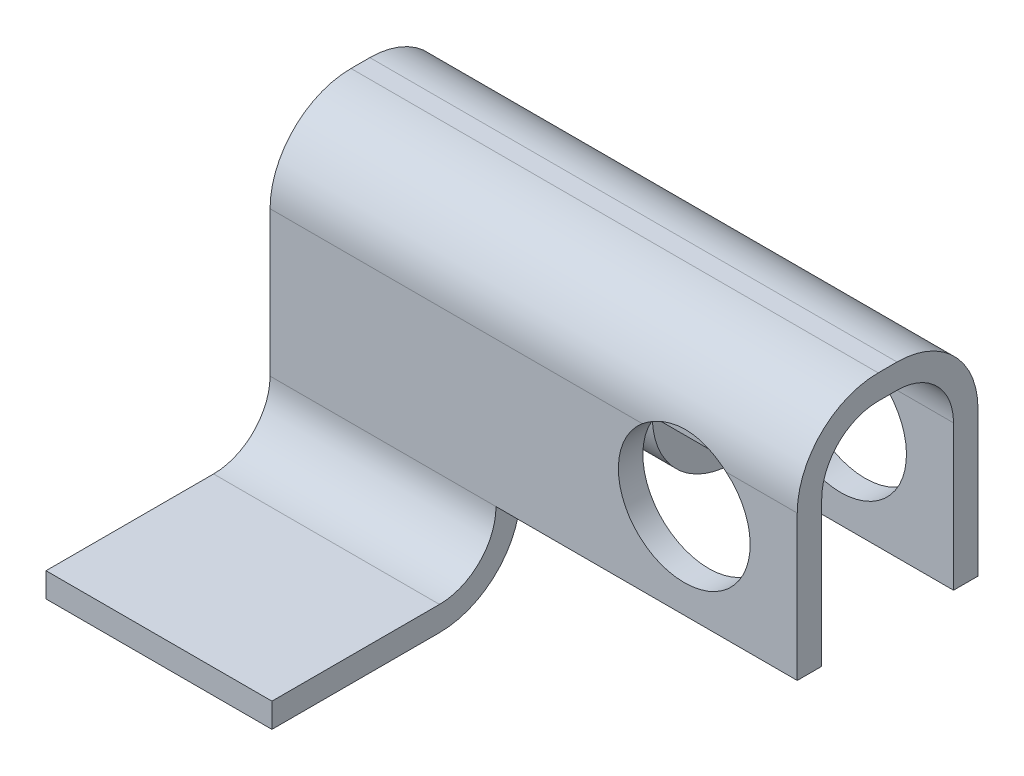
from build123d import *

# Parameters (mm, degrees)
EXTRUDE_1_DEPTH       = 14
CUT_EXTRUDE_START     = 3
SKETCH_3_W            = 16
SKETCH_3_H            = 33.4
CUT_EXTRUDE_1_DEPTH   = 30.455434224
HOLE_WIZARD_7_0_7_1_D = 7


with BuildPart() as part:
    # 草图1 → 拉伸-薄壁1 (new, symmetric)
    with BuildSketch(Plane(origin=(0, 0, 0), x_dir=(0, 0, -1), z_dir=(1, 0, 0))):
        with BuildLine():
            Line((-16.7, 0), (-7.8, 0))
            ThreePointArc((-7.8, 0), (-4.759440841, 1.259440841), (-3.5, 4.3))
            Line((-3.5, 4.3), (-3.5, 12))
            ThreePointArc((-3.5, 12), (-2.621320344, 14.121320344), (-0.5, 15))
            Line((-0.5, 15), (0.5, 15))
            ThreePointArc((0.5, 15), (2.621320344, 14.121320344), (3.5, 12))
            Line((3.5, 12), (3.5, 4.3))
            ThreePointArc((3.5, 4.3), (4.759440841, 1.259440841), (7.8, 0))
            Line((7.8, 0), (16.7, 0))
            Line((16.7, 0), (16.7, 1.3))
            Line((16.7, 1.3), (7.8, 1.3))
            ThreePointArc((7.8, 1.3), (5.678679656, 2.178679656), (4.8, 4.3))
            Line((4.8, 4.3), (4.8, 12))
            ThreePointArc((4.8, 12), (3.540559159, 15.040559159), (0.5, 16.3))
            Line((0.5, 16.3), (-0.5, 16.3))
            ThreePointArc((-0.5, 16.3), (-3.540559159, 15.040559159), (-4.8, 12))
            Line((-4.8, 12), (-4.8, 4.3))
            ThreePointArc((-4.8, 4.3), (-5.678679656, 2.178679656), (-7.8, 1.3))
            Line((-7.8, 1.3), (-16.7, 1.3))
            Line((-16.7, 1.3), (-16.7, 0))
        make_face()
    extrude(amount=EXTRUDE_1_DEPTH, both=True)

    # 草图3 → 切除-拉伸1 (cut, through all)
    with BuildSketch(Plane(origin=(0, 1.3, 0), x_dir=(1, 0, 0), z_dir=(0, 1, 0)).offset(CUT_EXTRUDE_START)):
        with Locations((6, 0)):
            Rectangle(SKETCH_3_W, SKETCH_3_H)
    extrude(amount=-CUT_EXTRUDE_1_DEPTH, mode=Mode.SUBTRACT)

    # Ø7.0 (7) 直径孔1 (through all)
    with Locations(Plane.XY.offset(4.8)):
        with Locations((8, 9.3)):
            Hole(HOLE_WIZARD_7_0_7_1_D / 2)


solid = part.part
